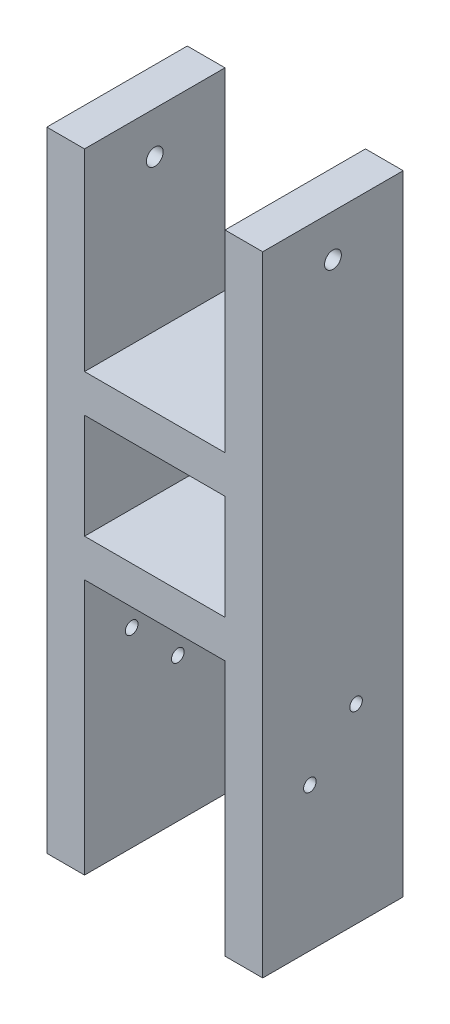
from build123d import *

# Parameters (mm, degrees)
SKETCH1_W           = 67
SKETCH1_H           = 50
BOSS_EXTRUDE3_DEPTH = 67
SKETCH2_R           = 3
SKETCH2_R_2         = 4
CUT_EXTRUDE1_DEPTH  = 18
CUT_EXTRUDE2_START  = -18
SKETCH3_R           = 3
SKETCH3_R_2         = 4
CUT_EXTRUDE2_DEPTH  = 18


with BuildPart() as part:
    # Sketch1 → Boss-Extrude3 (new body)
    with BuildSketch(Plane.XY):
        Polygon((1.330634734, 23.660498279), (1.330634734, -98.339501721), (-16.669365266, -98.339501721), (-16.669365266, 201.660498279), (1.330634734, 201.660498279), (1.330634734, 109.660498279), (68.330634734, 109.660498279), (68.330634734, 201.660498279), (86.330634734, 201.660498279), (86.330634734, -98.339501721), (68.330634734, -98.339501721), (68.330634734, 23.660498279), align=None)
        with Locations((34.830634734, 66.660498279)):
            Rectangle(SKETCH1_W, SKETCH1_H, mode=Mode.SUBTRACT)
    extrude(amount=BOSS_EXTRUDE3_DEPTH)

    # Sketch2 → Cut-Extrude1 (cut)
    with BuildSketch(Plane(origin=(86.330634734, 0, 0), x_dir=(0, 0, -1), z_dir=(1, 0, 0))):
        with Locations((-44.5, -29.839501721)):
            Circle(SKETCH2_R)
        with Locations((-22.5, -7.339501721)):
            Circle(SKETCH2_R)
        with Locations((-33.5, 181.660498279)):
            Circle(SKETCH2_R_2)
    extrude(amount=-CUT_EXTRUDE1_DEPTH, mode=Mode.SUBTRACT)

    # Sketch3 → Cut-Extrude2 (cut)
    with BuildSketch(Plane.ZY.offset(16.669365266).offset(CUT_EXTRUDE2_START)):
        with Locations(Location((22.5, -29.839501721, 0), (0, 0, 270))):
            Circle(SKETCH3_R)
        with Locations(Location((44.5, -7.339501721, 0), (0, 0, 270))):
            Circle(SKETCH3_R)
        with Locations(Location((33.5, 181.660498279, 0), (0, 0, 180))):
            Circle(SKETCH3_R_2)
    extrude(amount=CUT_EXTRUDE2_DEPTH, mode=Mode.SUBTRACT)


solid = part.part
